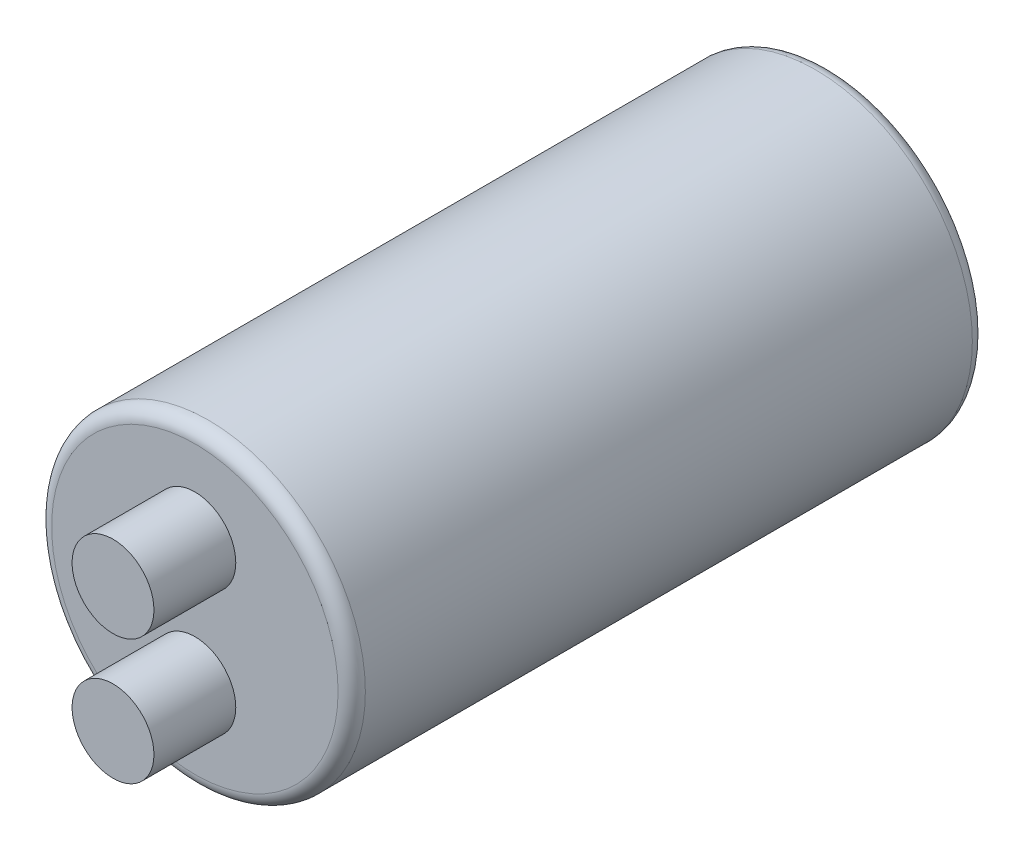
from build123d import *

# Parameters (mm, degrees)
SKETCH1_R           = 11.5
BOSS_EXTRUDE1_DEPTH = 46.5
FILLET1_R           = 1
SKETCH2_R           = 3
BOSS_EXTRUDE2_DEPTH = 6


with BuildPart() as part:
    # Sketch1 → Boss-Extrude1 (new body)
    with BuildSketch(Plane.XY):
        with Locations(Location((0, 0, 0), (0, 0, 180))):
            Circle(SKETCH1_R)
    extrude(amount=BOSS_EXTRUDE1_DEPTH)

    # Fillet1
    fillet1_edges = [part.edges().sort_by_distance(p)[0] for p in [
        (11.5, 0, 0),
        (11.5, 0, 46.5),
    ]]
    fillet(fillet1_edges, radius=FILLET1_R)

    # Sketch2 → Boss-Extrude2 (add)
    with BuildSketch(Plane.XY.offset(46.5)):
        with Locations((0, -4.744469282)):
            Circle(SKETCH2_R)
        with Locations((0, 4.441817119)):
            Circle(SKETCH2_R)
    extrude(amount=BOSS_EXTRUDE2_DEPTH)


solid = part.part
